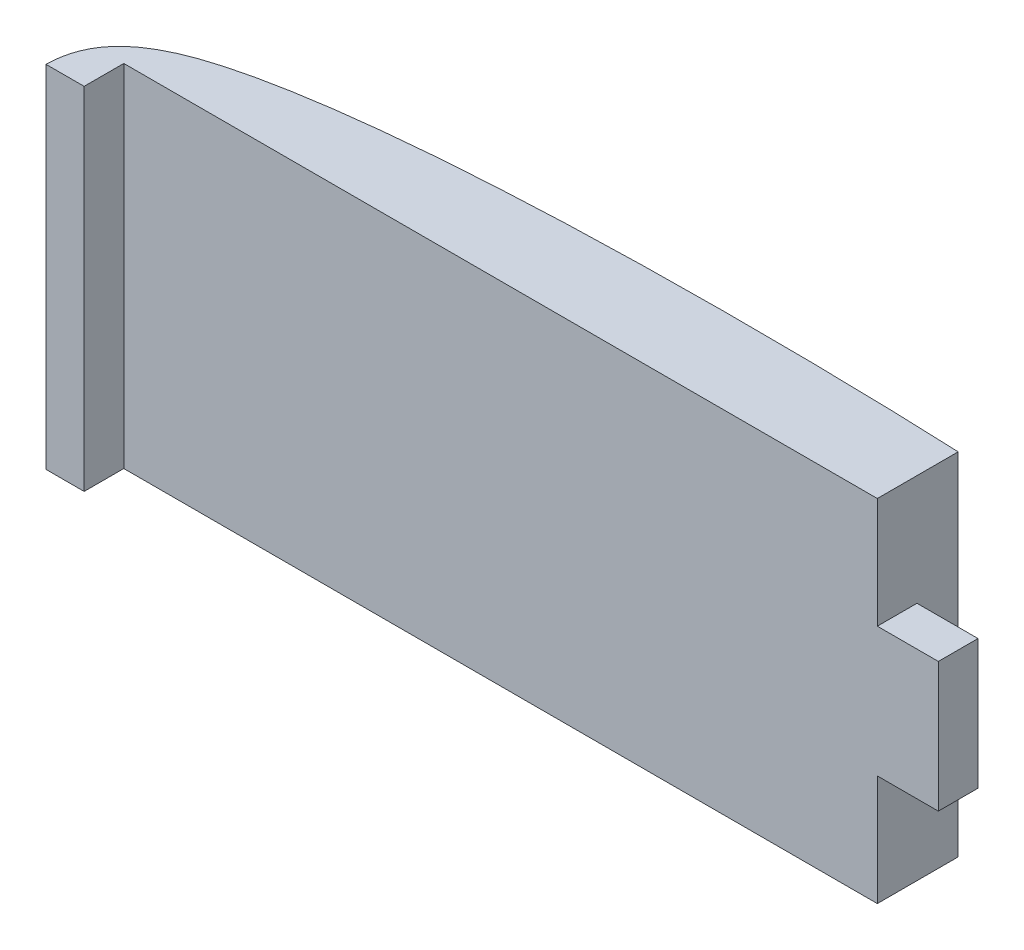
from build123d import *

# Parameters (mm, degrees)
EXTRUDE_1_DEPTH = 23
SKETCH_2_W      = 2.6
SKETCH_2_H      = 8.5
EXTRUDE_2_DEPTH = 4


with BuildPart() as part:
    # Эскиз1 → Бобышка-Вытянуть1 (new body)
    with BuildSketch(Plane(origin=(0, 0, 0), x_dir=(1, 0, 0), z_dir=(0, 1, 0))):
        with BuildLine():
            Line((0, 0), (0, 5.3))
            add(Edge.make_bspline(
                [(0, 5.3), (-7.993874465, 5.66903911), (-41.573220026, 6.372565792), (-51.847847743, 0.984637076), (-51.9, -2.6)],
                knots=[0, 0, 0, 0, 0.717430519, 1, 1, 1, 1], degree=3))
            Line((-51.9, -2.6), (-49.4, -2.6))
            Line((-49.4, -2.6), (-49.4, 0))
            Line((-49.4, 0), (0, 0))
        make_face()
    extrude(amount=EXTRUDE_1_DEPTH)

    # Эскиз2 → Бобышка-Вытянуть2 (add)
    with BuildSketch(Plane(origin=(0, 0, 0), x_dir=(0, 0, -1), z_dir=(1, 0, 0))):
        with Locations((1.3, 11.5)):
            Rectangle(SKETCH_2_W, SKETCH_2_H)
    extrude(amount=EXTRUDE_2_DEPTH)


solid = part.part
